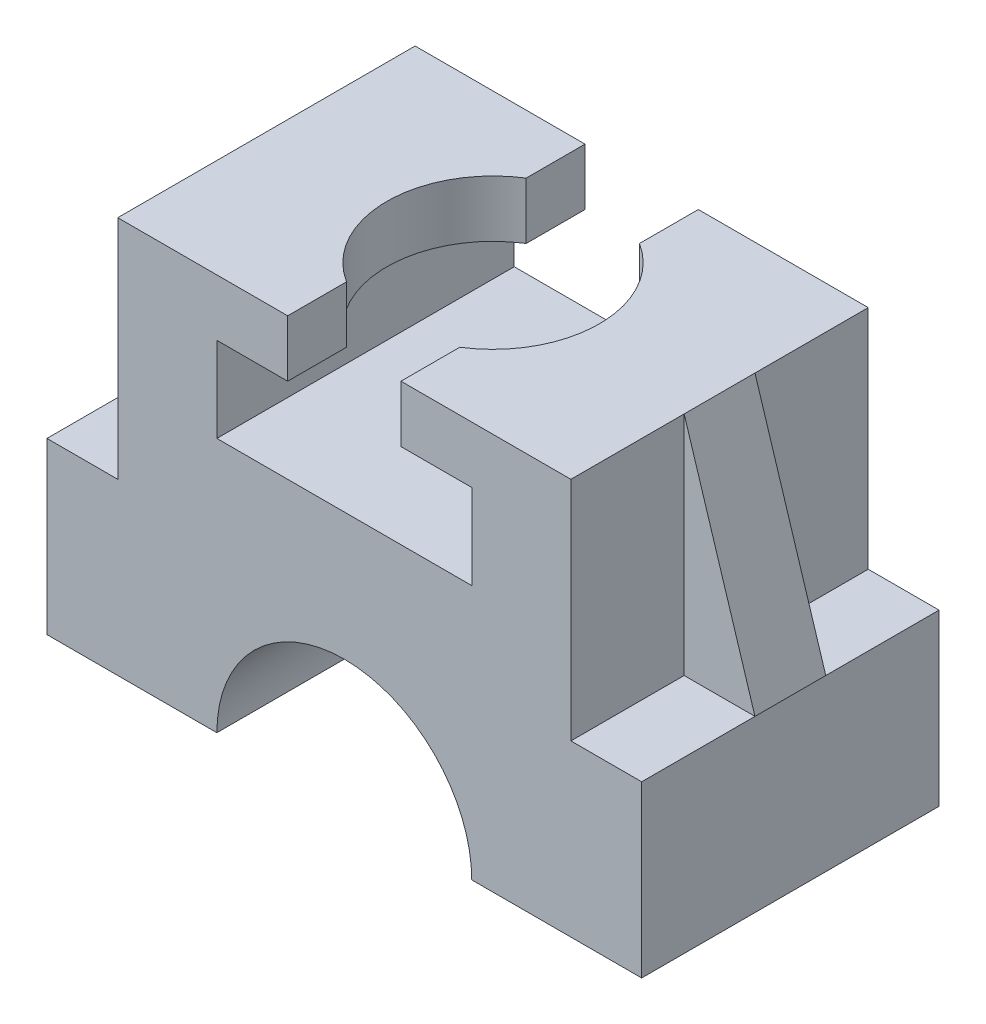
from build123d import *

# Parameters (mm, degrees)
BOSS_EXTRUDE1_DEPTH = 52.5
BOSS_EXTRUDE2_DEPTH = 12.5
SKETCH3_R           = 37.5
CUT_EXTRUDE1_DEPTH  = 20


with BuildPart() as part:
    # Sketch1 → Boss-Extrude1 (new, symmetric)
    with BuildSketch(Plane.XY):
        with BuildLine():
            Line((-105, 0), (-45, 0))
            ThreePointArc((-45, 0), (0, 45), (45, 0))
            Line((45, 0), (105, 0))
            Line((105, 0), (105, 60))
            Line((105, 60), (80, 60))
            Line((80, 60), (80, 140))
            Line((80, 140), (20, 140))
            Line((20, 140), (20, 120))
            Line((20, 120), (45, 120))
            Line((45, 120), (45, 90))
            Line((45, 90), (-45, 90))
            Line((-45, 90), (-45, 120))
            Line((-45, 120), (-20, 120))
            Line((-20, 120), (-20, 140))
            Line((-20, 140), (-80, 140))
            Line((-80, 140), (-80, 60))
            Line((-80, 60), (-105, 60))
            Line((-105, 60), (-105, 0))
        make_face()
    extrude(amount=BOSS_EXTRUDE1_DEPTH, both=True)

    # Sketch2 → Boss-Extrude2 (add, symmetric)
    with BuildSketch(Plane.XY):
        Polygon((80, 140), (80, 60), (105, 60), align=None)
        Polygon((-105, 60), (-80, 140), (-80, 60), align=None)
    extrude(amount=BOSS_EXTRUDE2_DEPTH, both=True)

    # Sketch3 → Cut-Extrude1 (cut)
    with BuildSketch(Plane(origin=(0, 140, 0), x_dir=(1, 0, 0), z_dir=(0, 1, 0))):
        Circle(SKETCH3_R)
    extrude(amount=-CUT_EXTRUDE1_DEPTH, mode=Mode.SUBTRACT)


solid = part.part
